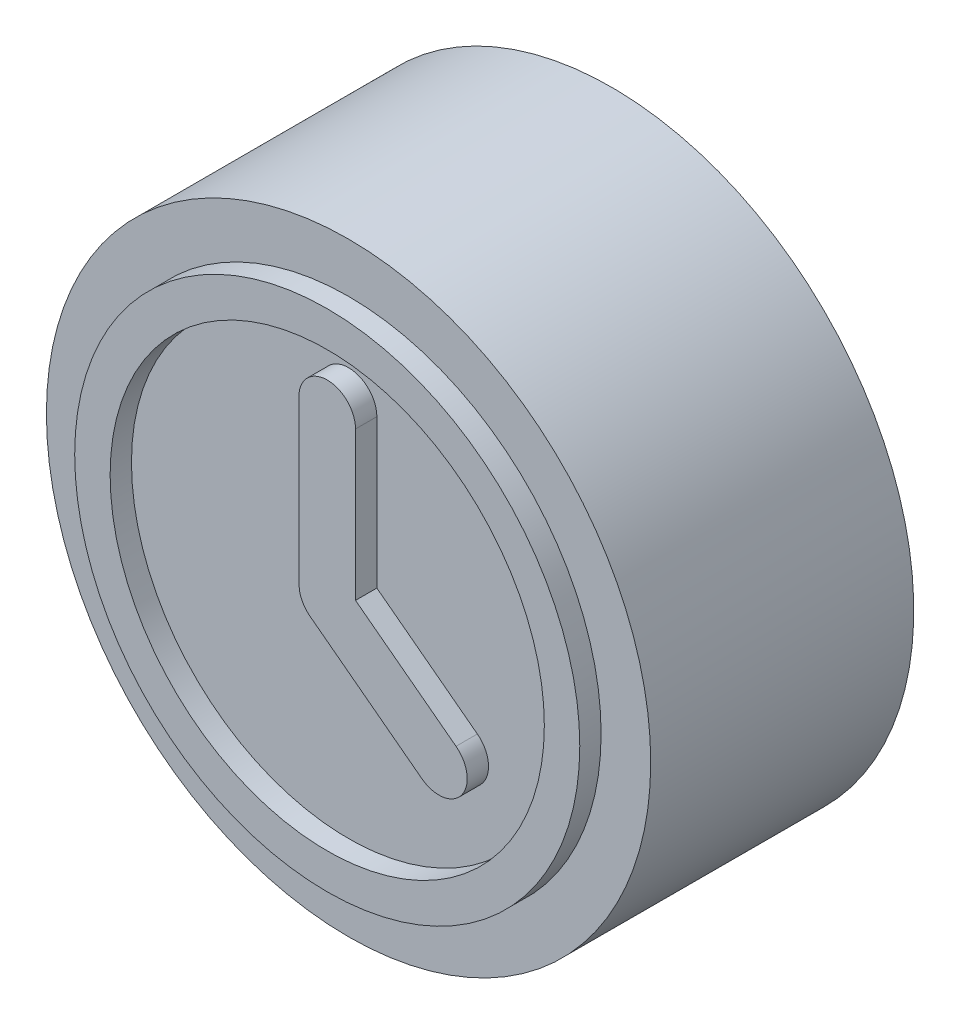
from build123d import *

# Parameters (mm, degrees)
SKETCH1_R           = 8.5
BOSS_EXTRUDE1_DEPTH = 4.4
SKETCH2_R           = 7.104307479
SKETCH2_R_2         = 6.107298405
BOSS_EXTRUDE2_DEPTH = 0.6
SKETCH3_R           = 5.8
CUT_EXTRUDE1_DEPTH  = 4
BOSS_EXTRUDE3_START = 3
SKETCH4_R           = 8.5
SKETCH4_R_2         = 7.5
BOSS_EXTRUDE3_DEPTH = 3


with BuildPart() as part:
    # Sketch1 → Boss-Extrude1 (new body)
    with BuildSketch(Plane.XY):
        Circle(SKETCH1_R)
    extrude(amount=BOSS_EXTRUDE1_DEPTH)

    # Sketch2 → Boss-Extrude2 (add)
    # profile 1 of 2: a face of its own
    with BuildSketch(Plane.XY.offset(4.4)):
        Circle(SKETCH2_R)
        Circle(SKETCH2_R_2, mode=Mode.SUBTRACT)
    # profile 2 of 2: a face of its own
    with BuildSketch(Plane.XY.offset(4.4)):
        with BuildLine():
            Line((-0.79575858, 0), (-0.79575858, 4.570978174))
            ThreePointArc((-0.79575858, 4.570978174), (0, 5.366736754), (0.79575858, 4.570978174))
            Line((0.79575858, 4.570978174), (0.79575858, 0.395496115))
            Line((0.79575858, 0.395496115), (3.622638776, -1.745931242))
            ThreePointArc((3.622638776, -1.745931242), (3.776443977, -2.860743961), (2.661631259, -3.014549161))
            Line((2.661631259, -3.014549161), (-0.480503759, -0.63430896))
            add(Edge.make_bspline(
                [(-0.79575858, 0), (-0.782929945, -0.180408247), (-0.768261528, -0.225601884), (-0.677231987, -0.437603968), (-0.573517685, -0.563848751), (-0.480503759, -0.63430896)],
                knots=[0, 0, 0, 0, 0.528419672, 0.628419672, 1, 1, 1, 1], degree=3))
        make_face()
    extrude(amount=BOSS_EXTRUDE2_DEPTH)

    # Sketch3 → Cut-Extrude1 (cut)
    with BuildSketch(Plane(origin=(0, 0, 0), x_dir=(-1, 0, 0), z_dir=(0, 0, -1))):
        Circle(SKETCH3_R)
    extrude(amount=-CUT_EXTRUDE1_DEPTH, mode=Mode.SUBTRACT)

    # Sketch4 → Boss-Extrude3 (add)
    with BuildSketch(Plane(origin=(0, 0, 0), x_dir=(-1, 0, 0), z_dir=(0, 0, -1)).offset(BOSS_EXTRUDE3_START)):
        Circle(SKETCH4_R)
        Circle(SKETCH4_R_2, mode=Mode.SUBTRACT)
    extrude(amount=-BOSS_EXTRUDE3_DEPTH)

    # Sketch6 → Cut-Revolve1 (revolve, cut)
    with BuildSketch(Plane(origin=(0, 0, 0), x_dir=(1, 0, 0), z_dir=(0, 1, 0)), mode=Mode.PRIVATE) as cut_revolve1_sk:
        Polygon((7.5, 0), (5.8, -1.7), (5.8, 0), align=None)
    revolve(cut_revolve1_sk.sketch.rotate(Axis((0, 0, -5.5), (0, 0, 1)), 180), axis=Axis((0, 0, -5.5), (0, 0, 1)), mode=Mode.SUBTRACT)


solid = part.part
